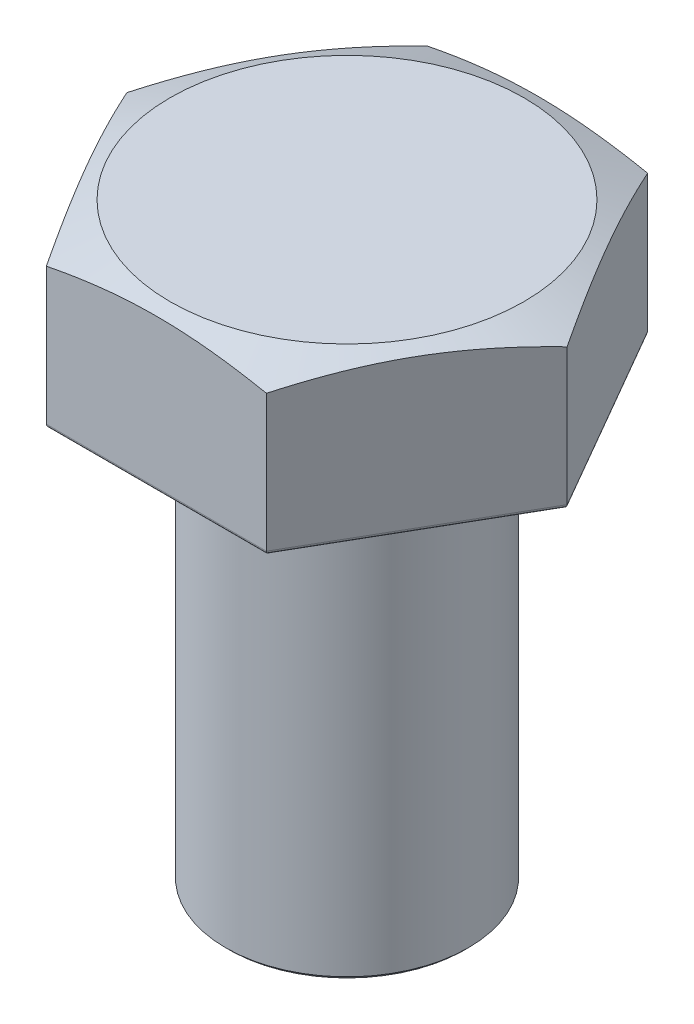
from build123d import *

# Parameters (mm, degrees)
EXTRUDE_1_DEPTH = 9.09
SKETCH_2_R      = 7
EXTRUDE_2_DEPTH = 25
CHAMFER_1_SIZE  = 0.2
FILLET_1_R      = 0.2


with BuildPart() as part:
    # 草图1 → 凸台-拉伸1 (new body)
    with BuildSketch(Plane(origin=(0, 0, 0), x_dir=(1, 0, 0), z_dir=(0, 1, 0))):
        Polygon((12.701705922, 0), (6.350852961, 11), (-6.350852961, 11), (-12.701705922, 0), (-6.350852961, -11), (6.350852961, -11), align=None)
    extrude(amount=EXTRUDE_1_DEPTH)

    # 草图2 → 凸台-拉伸2 (add)
    with BuildSketch(Plane.XZ):
        with Locations(Location((0, 0, 0), (0, 0, 270))):
            Circle(SKETCH_2_R)
    extrude(amount=EXTRUDE_2_DEPTH)

    # 倒角1
    chamfer_1_edges = [part.edges().sort_by_distance(p)[0] for p in [
        (0, 0, 7),
        (0, -25, 7),
    ]]
    chamfer(chamfer_1_edges, length=CHAMFER_1_SIZE)

    # 圆角1
    fillet_1_edges = [part.edges().sort_by_distance(p)[0] for p in [
        (0, 0, 7.2),
        (0, 0, 11),
        (-9.526279442, 0, 5.5),
        (-9.526279442, 0, -5.5),
        (0, 0, -11),
        (9.526279442, 0, -5.5),
        (9.526279442, 0, 5.5),
    ]]
    fillet(fillet_1_edges, radius=FILLET_1_R)

    # 草图3 → 切除-旋转1 (revolve, cut)
    with BuildSketch(Plane.XY, mode=Mode.PRIVATE) as cut_revolve_1_sk:
        Polygon((10.201705922, 9.09), (12.701705922, 9.09), (12.701705922, 8.09), align=None)
    revolve(cut_revolve_1_sk.sketch.rotate(Axis((0, 0, 0), (0, 1, 0)), 270), axis=Axis((0, 0, 0), (0, 1, 0)), mode=Mode.SUBTRACT)


solid = part.part
